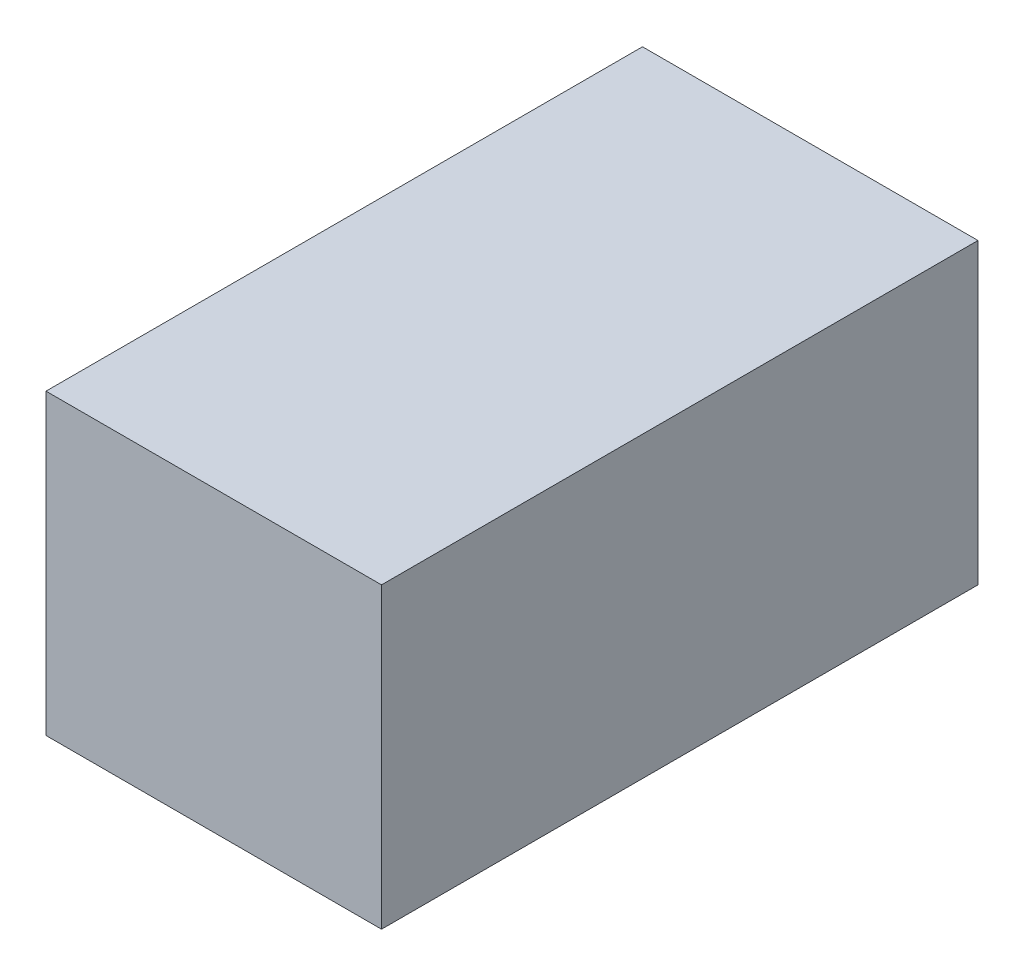
from build123d import *

# Parameters (mm, degrees)
SKETCH_1_W      = 80
SKETCH_1_H      = 40
EXTRUDE_1_DEPTH = 45


with BuildPart() as part:
    # 草图1 → 凸台-拉伸1 (new body)
    with BuildSketch(Plane(origin=(0, 0, 0), x_dir=(0, 0, -1), z_dir=(1, 0, 0))):
        with Locations((19.560067682, 22.115059222)):
            Rectangle(SKETCH_1_W, SKETCH_1_H)
    extrude(amount=EXTRUDE_1_DEPTH)


solid = part.part
